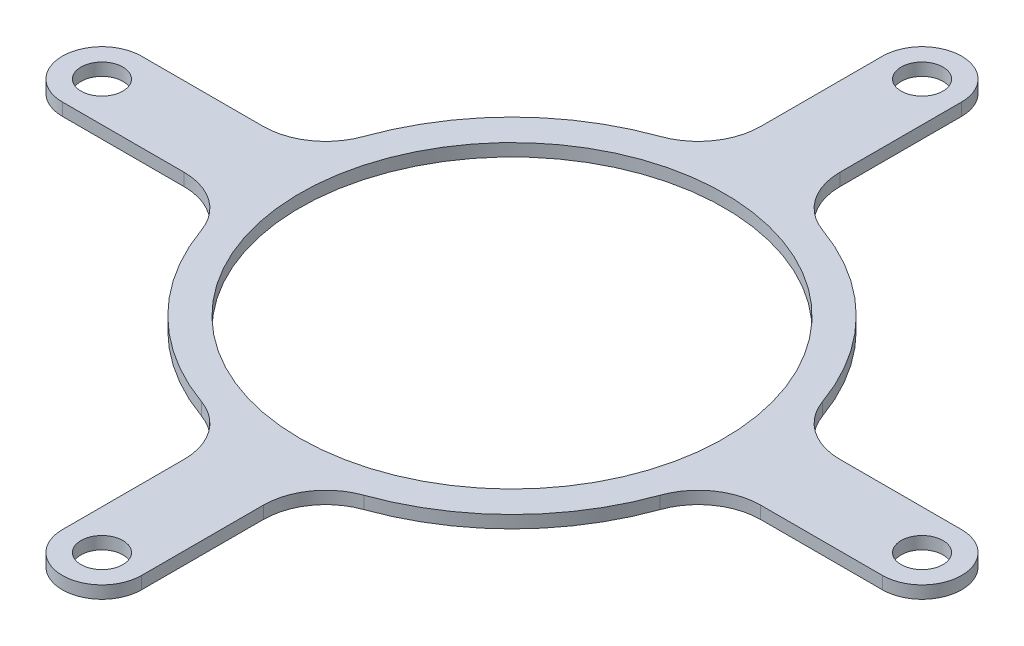
from build123d import *

# Parameters (mm, degrees)
SKETCH1_R           = 39
SKETCH1_R_2         = 34
BOSS_EXTRUDE1_DEPTH = 1
SKETCH2_R           = 3.35
BOSS_EXTRUDE2_DEPTH = 2
CIRPATTERN1_COUNT   = 4


with BuildPart() as part:
    # Sketch1 → Boss-Extrude1 (new, symmetric)
    with BuildSketch(Plane(origin=(0, 0, 0), x_dir=(1, 0, 0), z_dir=(0, 1, 0))):
        with Locations(Location((0, 0, 0), (0, 0, 270))):
            Circle(SKETCH1_R)
        with Locations(Location((0, 0, 0), (0, 0, 270))):
            Circle(SKETCH1_R_2, mode=Mode.SUBTRACT)
    extrude(amount=BOSS_EXTRUDE1_DEPTH, both=True)

    # Sketch2 → Boss-Extrude2 (add)
    with BuildSketch(Plane(origin=(0, 1, 0), x_dir=(1, 0, 0), z_dir=(0, 1, 0))):
        with BuildLine():
            Line((-6.35, 46.191747098), (-6.35, 65.7))
            ThreePointArc((-6.35, 65.7), (0, 72.05), (6.35, 65.7))
            Line((6.35, 65.7), (6.35, 46.191747098))
            ThreePointArc((6.35, 46.191747098), (8.183992807, 40.419717427), (13.013265306, 36.764859935))
            ThreePointArc((13.013265306, 36.764859935), (0, 39), (-13.013265306, 36.764859935))
            ThreePointArc((-13.013265306, 36.764859935), (-8.183992807, 40.419717427), (-6.35, 46.191747098))
        make_face()
        with Locations(Location((0, 65.7, 0), (0, 0, 270))):
            Circle(SKETCH2_R, mode=Mode.SUBTRACT)
    boss_extrude2 = extrude(amount=-BOSS_EXTRUDE2_DEPTH)

    # CirPattern1: Boss-Extrude2 ×4 about axis
    cirpattern1_axis = Axis((0, 0, 0), (0, 1, 0))
    for i in range(1, CIRPATTERN1_COUNT):
        add(boss_extrude2.rotate(cirpattern1_axis, i * 360 / CIRPATTERN1_COUNT))


solid = part.part
